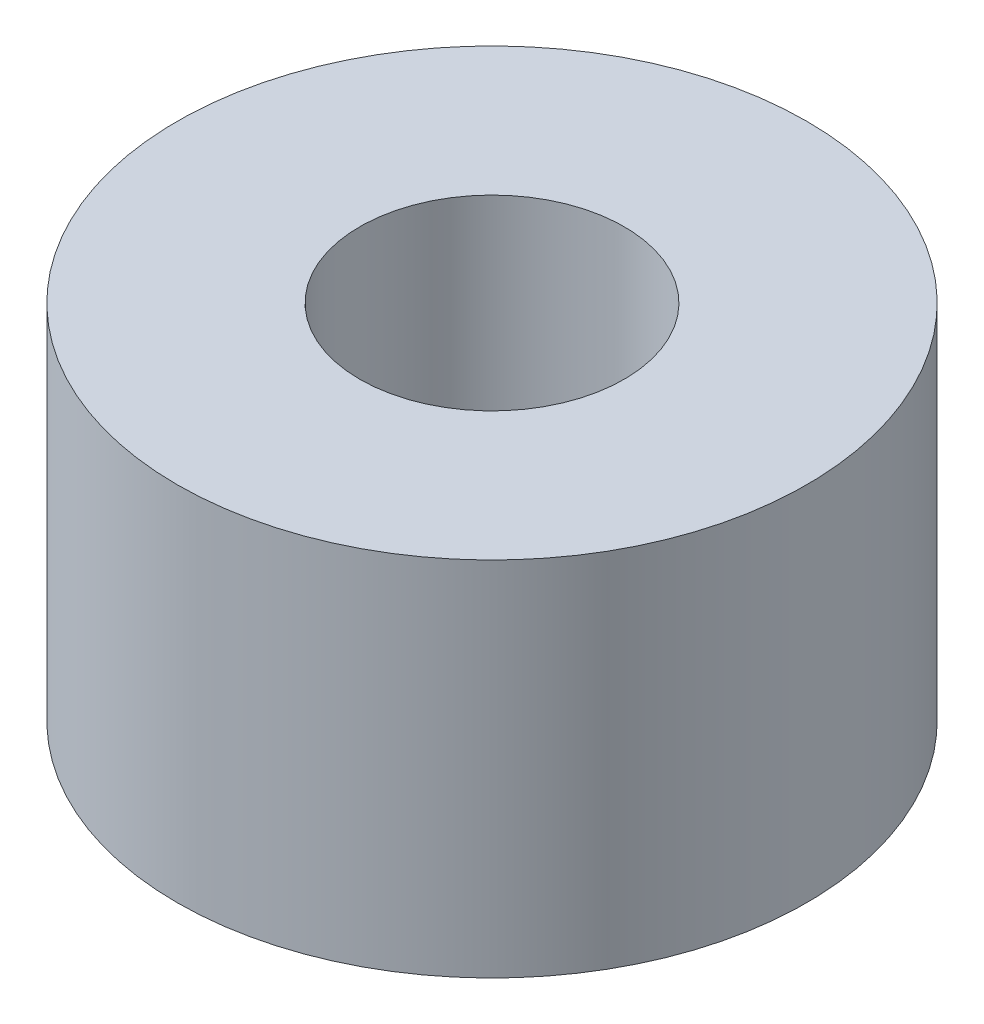
from build123d import *

# Parameters (mm, degrees)
SKETCH_1_R      = 5
SKETCH_1_R_2    = 2.1
EXTRUDE_1_DEPTH = 5.75


with BuildPart() as part:
    # ｽｹｯﾁ1 → ﾎﾞｽ - 押し出し1 (new body)
    with BuildSketch(Plane(origin=(0, 0, 0), x_dir=(1, 0, 0), z_dir=(0, 1, 0))):
        with Locations(Location((0, 0, 0), (0, 0, 270))):
            Circle(SKETCH_1_R)
        with Locations(Location((0, 0, 0), (0, 0, 270))):
            Circle(SKETCH_1_R_2, mode=Mode.SUBTRACT)
    extrude(amount=EXTRUDE_1_DEPTH)


solid = part.part
